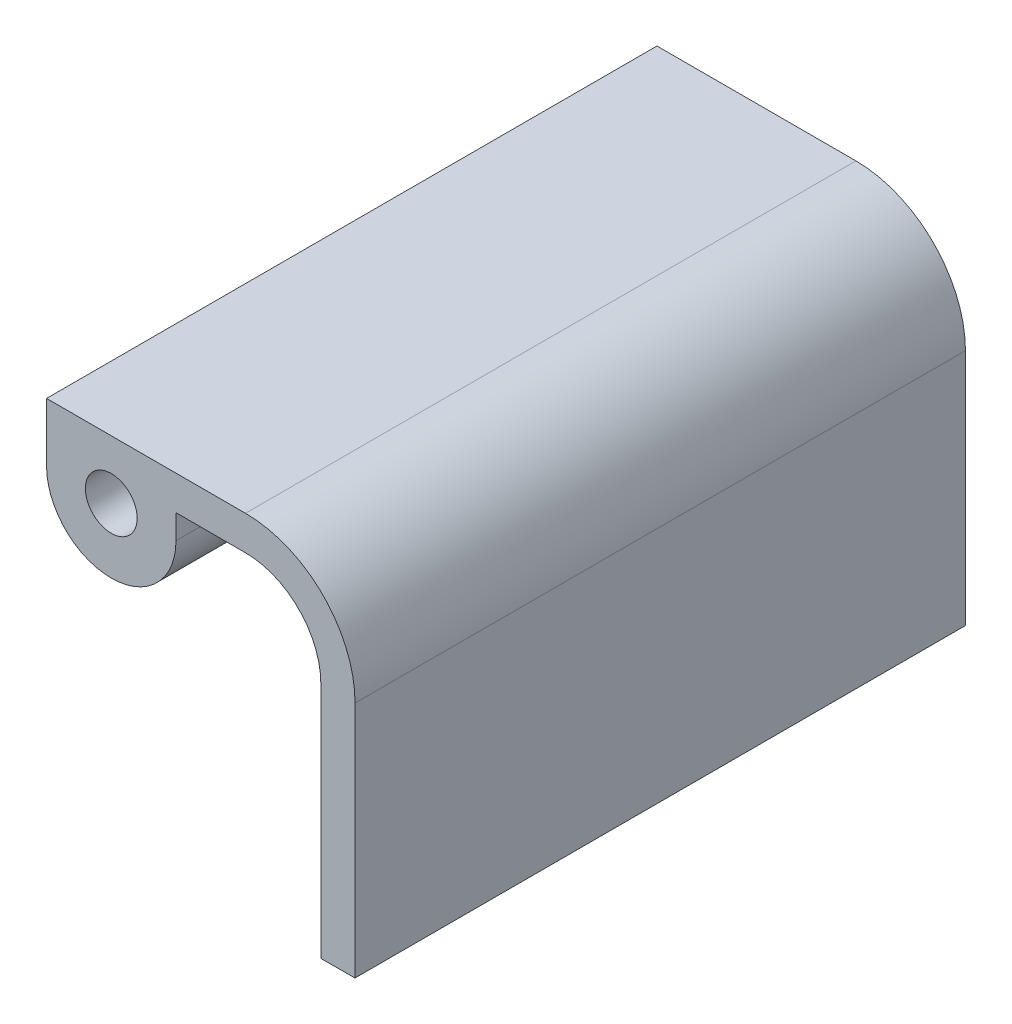
from build123d import *

# Parameters (mm, degrees)
SKETCH1_R           = 2.4
BOSS_EXTRUDE1_DEPTH = 56.59882


with BuildPart() as part:
    # Sketch1 → Boss-Extrude1 (new body)
    with BuildSketch(Plane.XY):
        with BuildLine():
            Line((-76.173191063, 182.117156823), (-79.348191063, 182.096951811))
            Line((-79.348191063, 182.096951811), (-79.348191063, 204.196458108))
            ThreePointArc((-79.348191063, 204.196458108), (-81.394050197, 209.135598974), (-86.333191063, 211.181458108))
            Line((-86.333191063, 211.181458108), (-92.778191065, 211.181458108))
            Line((-92.778191065, 211.181458108), (-92.778191065, 208.926458108))
            ThreePointArc((-92.778191065, 208.926458108), (-98.778191065, 202.926458108), (-104.778191065, 208.926458108))
            Line((-104.778191065, 208.926458108), (-104.778191065, 214.356458108))
            Line((-104.778191065, 214.356458108), (-92.778191065, 214.356458108))
            Line((-92.778191065, 214.356458108), (-86.333191063, 214.356458108))
            ThreePointArc((-86.333191063, 214.356458108), (-79.148986166, 211.380663005), (-76.173191063, 204.196458108))
            Line((-76.173191063, 204.196458108), (-76.173191063, 182.117156823))
        make_face()
        with Locations((-98.778191065, 208.926458108)):
            Circle(SKETCH1_R, mode=Mode.SUBTRACT)
    extrude(amount=BOSS_EXTRUDE1_DEPTH)


solid = part.part
